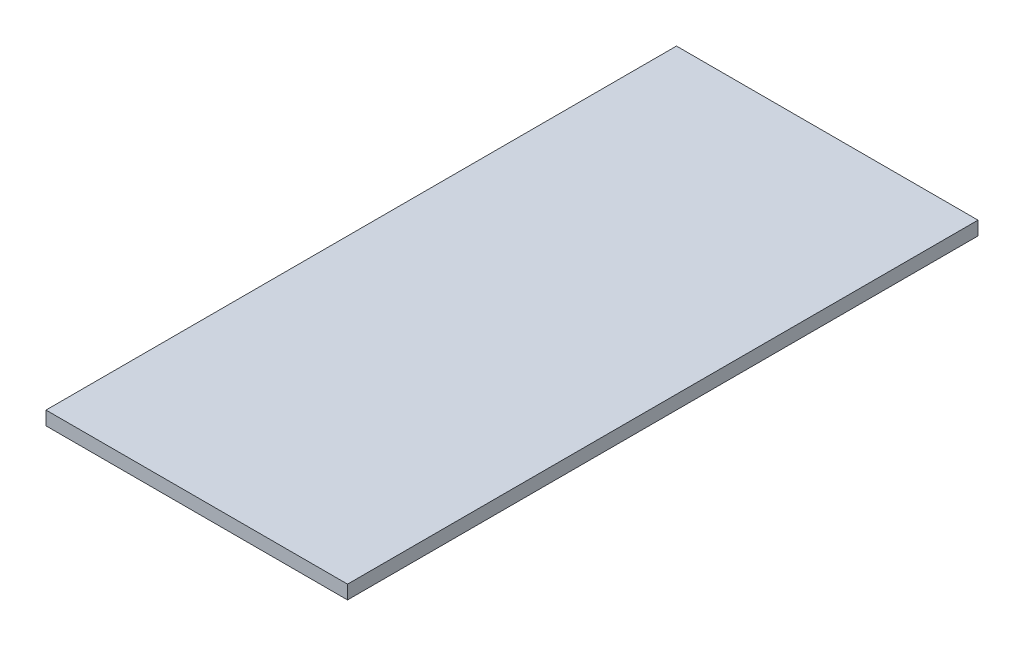
from build123d import *

# Parameters (mm, degrees)
SKETCH1_W           = 279.4
SKETCH1_H           = 584.2
BOSS_EXTRUDE1_DEPTH = 12.7


with BuildPart() as part:
    # Sketch1 → Boss-Extrude1 (new body)
    with BuildSketch(Plane(origin=(0, 0, 0), x_dir=(1, 0, 0), z_dir=(0, 1, 0))):
        Rectangle(SKETCH1_W, SKETCH1_H)
    extrude(amount=BOSS_EXTRUDE1_DEPTH)


solid = part.part
